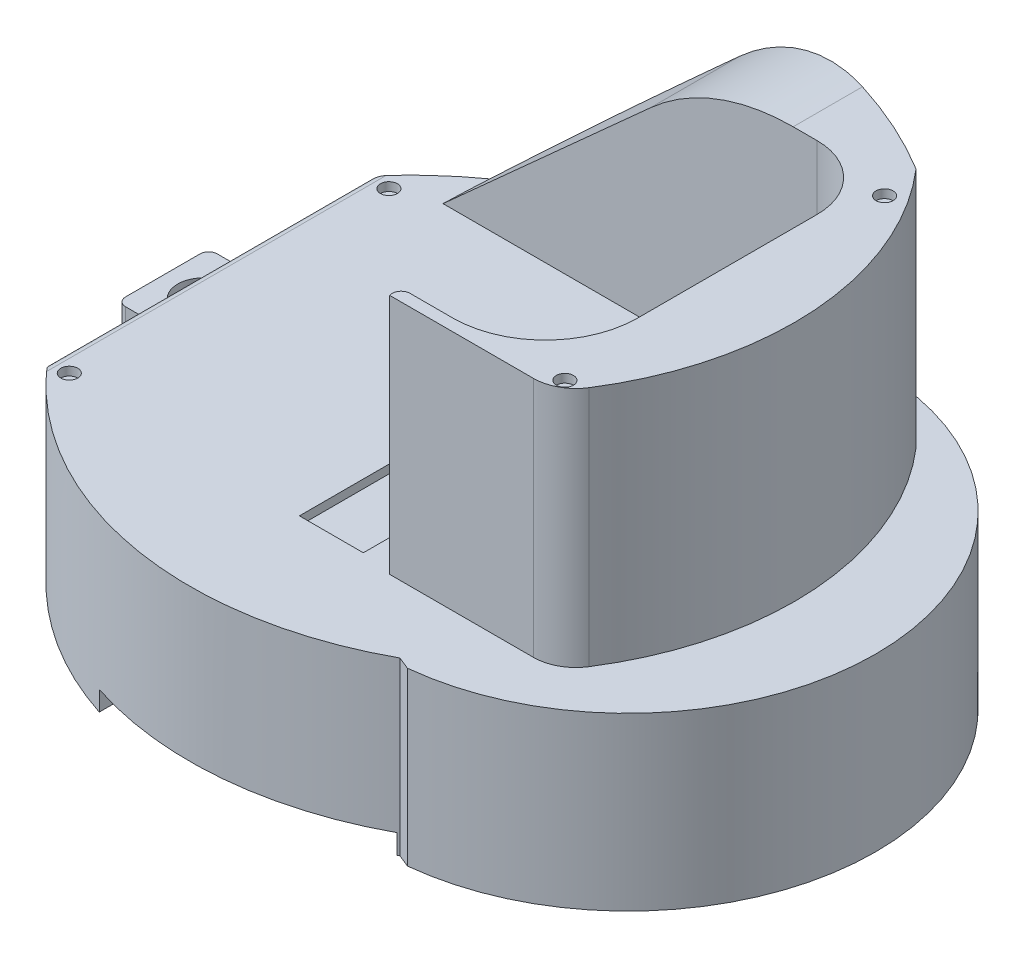
from build123d import *

# Parameters (mm, degrees)
BOSS_EXTRUDE1_DEPTH     = 402
BOSS_EXTRUDE2_DEPTH     = 969
CUT_EXTRUDE1_DEPTH      = 1960.325116763
FILLET1_R               = 500
CUT_EXTRUDE2_START      = 402
SKETCH4_W               = 150
SKETCH4_H               = 750
CUT_EXTRUDE2_DEPTH      = 20
SKETCH7_R               = 20
CUT_EXTRUDE3_DEPTH      = 20
SKETCH8_R               = 20
CUT_EXTRUDE4_DEPTH      = 20
BOSS_EXTRUDE3_START     = -10
BOSS_EXTRUDE3_DEPTH     = 215
FILLET2_R               = 20
CUT_EXTRUDE5_DEPTH      = 226
CUT_EXTRUDE5_DEPTH_BACK = 1960.325116812
SKETCH10_R              = 60
CHAMFER1_SIZE           = 50
CHAMFER1_SIZE2          = 41.954981559
FILLET3_R               = 20
SKETCH11_R              = 315
CUT_EXTRUDE6_DEPTH      = 66
CUT_EXTRUDE7_DEPTH      = 1960.325116812
CUT_EXTRUDE7_DEPTH_BACK = 1960.325116812
SKETCH12_W              = 640
SKETCH12_H              = 46


with BuildPart() as part:
    # Sketch1 → Boss-Extrude1 (new body)
    with BuildSketch(Plane(origin=(0, 0, 0), x_dir=(1, 0, 0), z_dir=(0, 1, 0))):
        with BuildLine():
            Line((1046.337061031, 577.858493981), (1016.667317849, 565.870736079))
            ThreePointArc((1016.667317849, 565.870736079), (522.188011035, 660.289732015), (66.74007867, 445.832480877))
            ThreePointArc((66.74007867, 445.832480877), (33.691690874, 412.919114907), (2.599998001, 378.151425458))
            ThreePointArc((2.599998001, 378.151425458), (1.291392319, 376.582813438), (0, 375))
            Line((0, 375), (0, -375))
            ThreePointArc((0, -375), (1.291392319, -376.582813438), (2.599998001, -378.151425458))
            ThreePointArc((2.599998001, -378.151425458), (33.691690874, -412.919114907), (66.74007867, -445.832480877))
            ThreePointArc((66.74007867, -445.832480877), (522.187167102, -660.28962537), (1016.665827322, -565.871556268))
            Line((1016.665827322, -565.871556268), (1046.335850828, -577.858620343))
            ThreePointArc((1046.335850828, -577.858620343), (1567, -0.000608391), (1046.337061031, 577.858493981))
        make_face()
    extrude(amount=BOSS_EXTRUDE1_DEPTH)

    # Sketch2 → Boss-Extrude2 (add)
    with BuildSketch(Plane(origin=(0, 0, 0), x_dir=(1, 0, 0), z_dir=(0, 1, 0))):
        with BuildLine():
            Line((144, 408), (1021.890739397, 408))
            ThreePointArc((1021.890739397, 408), (1127.956756575, 364.066017178), (1171.890739397, 258))
            Line((1171.890739397, 258), (1171.890739397, -163))
            ThreePointArc((1171.890739397, -163), (1108.332910914, -316.442171517), (954.890739397, -380))
            Line((954.890739397, -380), (854.68972927, -380))
            ThreePointArc((854.68972927, -380), (837.543301071, -388.875644347), (834.890739397, -408))
            Line((834.890739397, -408), (1171.890739397, -408))
            ThreePointArc((1171.890739397, -408), (1219.999604094, -395.667195333), (1256.24212417, -361.710742752))
            ThreePointArc((1256.24212417, -361.710742752), (1363.13459057, 62.465453501), (1195.440223215, 466.482834313))
            ThreePointArc((1195.440223215, 466.482834313), (833.097116799, 602.555696564), (446.106721665, 595.715763658))
            ThreePointArc((446.106721665, 595.715763658), (307.869625647, 548.008401888), (185.923871205, 467.294586118))
            ThreePointArc((185.923871205, 467.294586118), (161.31953374, 440.222630818), (144, 408))
        make_face()
    extrude(amount=BOSS_EXTRUDE2_DEPTH)

    # Sketch3 → Cut-Extrude1 (cut, through all)
    with BuildSketch(Plane.XY):
        Polygon((144, 402), (773.717295908, 969), (144, 969), align=None)
    extrude(amount=-CUT_EXTRUDE1_DEPTH, mode=Mode.SUBTRACT)

    # Fillet1
    fillet1_edges = [part.edges().sort_by_distance(p)[0] for p in [
        (773.717295908, 969, -509.514721406),
    ]]
    fillet(fillet1_edges, radius=FILLET1_R)

    # Sketch4 → Cut-Extrude2 (cut)
    with BuildSketch(Plane(origin=(0, 0, 0), x_dir=(1, 0, 0), z_dir=(0, 1, 0)).offset(CUT_EXTRUDE2_START)):
        with Locations((685, -20)):
            Rectangle(SKETCH4_W, SKETCH4_H)
    extrude(amount=-CUT_EXTRUDE2_DEPTH, mode=Mode.SUBTRACT)

    # Sketch7 → Cut-Extrude3 (cut)
    with BuildSketch(Plane(origin=(0, 402, 0), x_dir=(1, 0, 0), z_dir=(0, 1, 0))):
        with Locations(Location((50, 375, 0), (0, 0, 270))):
            Circle(SKETCH7_R)
        with Locations(Location((50, -375, 0), (0, 0, 270))):
            Circle(SKETCH7_R)
    extrude(amount=-CUT_EXTRUDE3_DEPTH, mode=Mode.SUBTRACT)

    # Sketch8 → Cut-Extrude4 (cut)
    with BuildSketch(Plane(origin=(0, 969, 0), x_dir=(1, 0, 0), z_dir=(0, 1, 0))):
        with Locations(Location((1213, 375, 0), (0, 0, 270))):
            Circle(SKETCH8_R)
        with Locations(Location((1213, -375, 0), (0, 0, 270))):
            Circle(SKETCH8_R)
    extrude(amount=-CUT_EXTRUDE4_DEPTH, mode=Mode.SUBTRACT)

    # Sketch9 → Boss-Extrude3 (add)
    with BuildSketch(Plane.XY.offset(BOSS_EXTRUDE3_START)):
        Polygon((0, 0), (357, 0), (357, -28), (-223, -28), (-223, 17), (-128, 17), (-128, 173), (-223, 173), (-223, 218), (0, 218), align=None)
    extrude(amount=-BOSS_EXTRUDE3_DEPTH)

    # Fillet2
    fillet2_edges = [part.edges().sort_by_distance(p)[0] for p in [
        (-223, -5.5, -10),
        (-223, 195.5, -10),
        (-223, -5.5, -225),
        (-223, 195.5, -225),
    ]]
    fillet(fillet2_edges, radius=FILLET2_R)

    # Sketch10 → Cut-Extrude5 (cut, two sides: drawn at the far end of the back side and taken through both)
    with BuildSketch(Plane(origin=(0, 0, 0), x_dir=(1, 0, 0), z_dir=(0, 1, 0)).offset(-CUT_EXTRUDE5_DEPTH_BACK)):
        with Locations(Location((-128, 117.5, 0), (0, 0, 270))):
            Circle(SKETCH10_R)
    extrude(amount=CUT_EXTRUDE5_DEPTH + CUT_EXTRUDE5_DEPTH_BACK, mode=Mode.SUBTRACT)

    # Chamfer1
    chamfer1_edges = [part.edges().sort_by_distance(p)[0] for p in [
        (0, 0, -300),
        (0, 0, 182.5),
    ]]
    chamfer1_side = [part.faces().sort_by_distance(p)[0] for p in [
        (765.492068196, 0, 5.511575813),
    ]]
    chamfer(chamfer1_edges, length=CHAMFER1_SIZE, length2=CHAMFER1_SIZE2, reference=chamfer1_side[0])

    # Fillet3
    fillet3_edges = [part.edges().sort_by_distance(p)[0] for p in [
        (0, 402, 0),
    ]]
    fillet(fillet3_edges, radius=FILLET3_R)

    # Sketch11 → Cut-Extrude6 (cut)
    with BuildSketch(Plane(origin=(0, 0, 0), x_dir=(1, 0, 0), z_dir=(0, 1, 0))):
        with Locations(Location((687, 0, 0), (0, 0, 270))):
            Circle(SKETCH11_R)
    extrude(amount=CUT_EXTRUDE6_DEPTH, mode=Mode.SUBTRACT)

    # Sketch12 → Cut-Extrude7 (cut, two sides: drawn at the far end of the back side and taken through both)
    with BuildSketch(Plane.XY.offset(-CUT_EXTRUDE7_DEPTH_BACK)):
        with Locations((692, 23)):
            Rectangle(SKETCH12_W, SKETCH12_H)
    extrude(amount=CUT_EXTRUDE7_DEPTH + CUT_EXTRUDE7_DEPTH_BACK, mode=Mode.SUBTRACT)


solid = part.part
